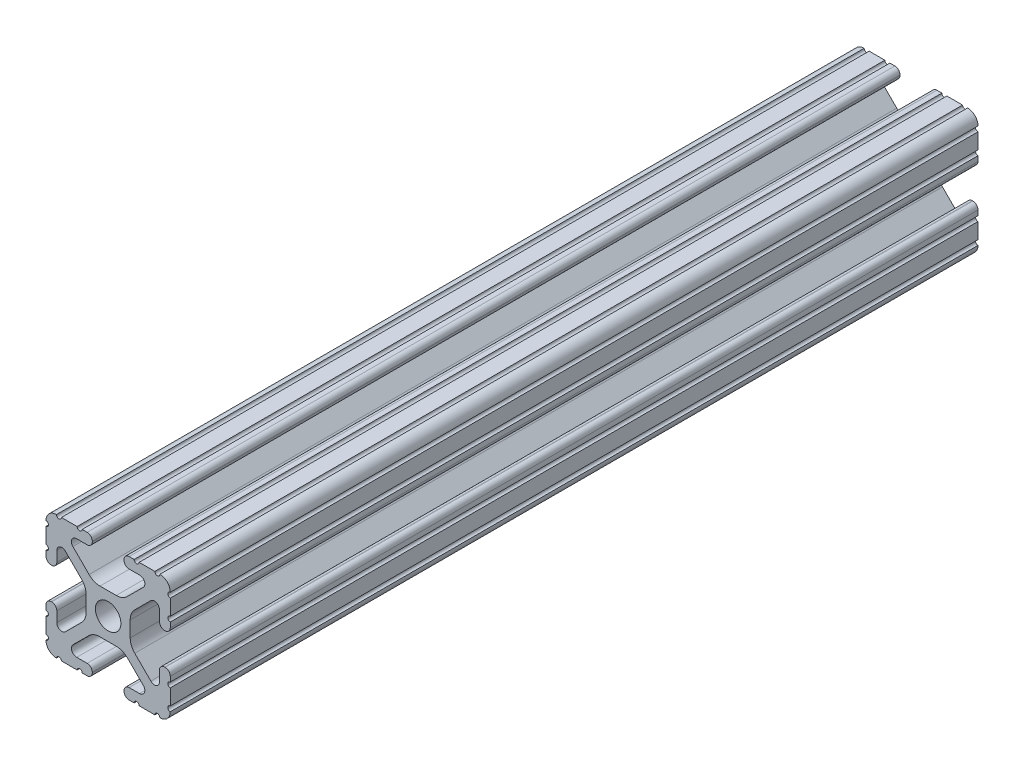
from build123d import *

# Parameters (mm, degrees)
SKETCH1_R           = 2.6035
BOSS_EXTRUDE1_DEPTH = 152.4
SKETCH3_W           = 25.4
SKETCH3_H           = 25.4
CUT_EXTRUDE1_DEPTH  = 139.7


with BuildPart() as part:
    # Sketch1 → Boss-Extrude1 (new, symmetric)
    with BuildSketch(Plane.XY):
        with BuildLine():
            Line((-7.179650497, -8.645192506), (-3.952270251, -5.423690499))
            ThreePointArc((-3.952270251, -5.423690499), (-2.922936451, -4.736929036), (-1.709253557, -4.4958))
            Line((-1.709253557, -4.4958), (1.709253557, -4.4958))
            ThreePointArc((1.709253557, -4.4958), (2.922936451, -4.736929036), (3.952270251, -5.423690499))
            Line((3.952270251, -5.423690499), (7.179650497, -8.645192506))
            ThreePointArc((7.179650497, -8.645192506), (7.41473083, -9.822813117), (6.416408329, -10.4902))
            Line((6.416408329, -10.4902), (4.287512407, -10.4902))
            ThreePointArc((4.287512407, -10.4902), (3.54574862, -10.79744862), (3.2385, -11.539212407))
            Line((3.2385, -11.539212407), (3.2385, -11.650987593))
            ThreePointArc((3.2385, -11.650987593), (3.54574862, -12.39275138), (4.287512407, -12.7))
            Line((4.287512407, -12.7), (5.317126718, -12.7))
            ThreePointArc((5.317126718, -12.7), (5.825126718, -12.192), (6.333126718, -12.7))
            Line((6.333126718, -12.7), (9.550443118, -12.7))
            ThreePointArc((9.550443118, -12.7), (10.058366869, -12.192000006), (10.566443095, -12.699847501))
            ThreePointArc((10.566443095, -12.699847501), (12.082537762, -12.08250727), (12.699846982, -10.566399977))
            ThreePointArc((12.699846982, -10.566399977), (12.192000006, -10.058323491), (12.7, -9.5504))
            Line((12.7, -9.5504), (12.7, -6.3330836))
            ThreePointArc((12.7, -6.3330836), (12.192, -5.8250836), (12.7, -5.3170836))
            Line((12.7, -5.3170836), (12.7, -4.287469289))
            ThreePointArc((12.7, -4.287469289), (12.39275138, -3.545705502), (11.650987593, -3.238456882))
            Line((11.650987593, -3.238456882), (11.539212407, -3.238456882))
            ThreePointArc((11.539212407, -3.238456882), (10.79744862, -3.545705502), (10.4902, -4.287469289))
            Line((10.4902, -4.287469289), (10.4902, -6.402089023))
            ThreePointArc((10.4902, -6.402089023), (9.856505071, -7.351067942), (8.737131347, -7.129408934))
            Line((8.737131347, -7.129408934), (5.441005833, -3.840816462))
            ThreePointArc((5.441005833, -3.840816462), (4.750877967, -2.809883091), (4.5085, -1.593185507))
            Line((4.5085, -1.593185507), (4.5085, 1.593185507))
            ThreePointArc((4.5085, 1.593185507), (4.750877967, 2.809883091), (5.441005833, 3.840816462))
            Line((5.441005833, 3.840816462), (8.737131347, 7.129408934))
            ThreePointArc((8.737131347, 7.129408934), (9.856505071, 7.351067942), (10.4902, 6.402089023))
            Line((10.4902, 6.402089023), (10.4902, 4.287469289))
            ThreePointArc((10.4902, 4.287469289), (10.79744862, 3.545705502), (11.539212407, 3.238456882))
            Line((11.539212407, 3.238456882), (11.650987593, 3.238456882))
            ThreePointArc((11.650987593, 3.238456882), (12.39275138, 3.545705502), (12.7, 4.287469289))
            Line((12.7, 4.287469289), (12.7, 5.3170836))
            ThreePointArc((12.7, 5.3170836), (12.192, 5.8250836), (12.7, 6.3330836))
            Line((12.7, 6.3330836), (12.7, 9.5504))
            ThreePointArc((12.7, 9.5504), (12.192000006, 10.058323491), (12.699846982, 10.566399977))
            ThreePointArc((12.699846982, 10.566399977), (12.082537762, 12.08250727), (10.566443095, 12.699847501))
            ThreePointArc((10.566443095, 12.699847501), (10.058366869, 12.192000006), (9.550443118, 12.7))
            Line((9.550443118, 12.7), (6.333126718, 12.7))
            ThreePointArc((6.333126718, 12.7), (5.825126718, 12.192), (5.317126718, 12.7))
            Line((5.317126718, 12.7), (4.287512407, 12.7))
            ThreePointArc((4.287512407, 12.7), (3.54574862, 12.39275138), (3.2385, 11.650987593))
            Line((3.2385, 11.650987593), (3.2385, 11.539212407))
            ThreePointArc((3.2385, 11.539212407), (3.54574862, 10.79744862), (4.287512407, 10.4902))
            Line((4.287512407, 10.4902), (6.476788598, 10.4902))
            ThreePointArc((6.476788598, 10.4902), (7.432222385, 9.85140422), (7.207036008, 8.724370562))
            Line((7.207036008, 8.724370562), (3.898272566, 5.423169045))
            ThreePointArc((3.898272566, 5.423169045), (2.869120213, 4.736787962), (1.655778399, 4.4958))
            Line((1.655778399, 4.4958), (-1.655778399, 4.4958))
            ThreePointArc((-1.655778399, 4.4958), (-2.869120213, 4.736787962), (-3.898272566, 5.423169045))
            Line((-3.898272566, 5.423169045), (-7.207036008, 8.724370562))
            ThreePointArc((-7.207036008, 8.724370562), (-7.432222385, 9.85140422), (-6.476788598, 10.4902))
            Line((-6.476788598, 10.4902), (-4.287512407, 10.4902))
            ThreePointArc((-4.287512407, 10.4902), (-3.54574862, 10.79744862), (-3.2385, 11.539212407))
            Line((-3.2385, 11.539212407), (-3.2385, 11.650987593))
            ThreePointArc((-3.2385, 11.650987593), (-3.54574862, 12.39275138), (-4.287512407, 12.7))
            Line((-4.287512407, 12.7), (-5.317126718, 12.7))
            ThreePointArc((-5.317126718, 12.7), (-5.825126718, 12.192), (-6.333126718, 12.7))
            Line((-6.333126718, 12.7), (-9.550443118, 12.7))
            ThreePointArc((-9.550443118, 12.7), (-10.058366869, 12.192000006), (-10.566443095, 12.699847501))
            ThreePointArc((-10.566443095, 12.699847501), (-12.082537762, 12.08250727), (-12.699846982, 10.566399977))
            ThreePointArc((-12.699846982, 10.566399977), (-12.192000006, 10.058323491), (-12.7, 9.5504))
            Line((-12.7, 9.5504), (-12.7, 6.3330836))
            ThreePointArc((-12.7, 6.3330836), (-12.192, 5.8250836), (-12.7, 5.3170836))
            Line((-12.7, 5.3170836), (-12.7, 4.287469289))
            ThreePointArc((-12.7, 4.287469289), (-12.39275138, 3.545705502), (-11.650987593, 3.238456882))
            Line((-11.650987593, 3.238456882), (-11.539212407, 3.238456882))
            ThreePointArc((-11.539212407, 3.238456882), (-10.79744862, 3.545705502), (-10.4902, 4.287469289))
            Line((-10.4902, 4.287469289), (-10.4902, 6.402089023))
            ThreePointArc((-10.4902, 6.402089023), (-9.856505071, 7.351067942), (-8.737131347, 7.129408934))
            Line((-8.737131347, 7.129408934), (-5.441005833, 3.840816462))
            ThreePointArc((-5.441005833, 3.840816462), (-4.750877967, 2.809883091), (-4.5085, 1.593185507))
            Line((-4.5085, 1.593185507), (-4.5085, -1.593185507))
            ThreePointArc((-4.5085, -1.593185507), (-4.750877967, -2.809883091), (-5.441005833, -3.840816462))
            Line((-5.441005833, -3.840816462), (-8.737131347, -7.129408934))
            ThreePointArc((-8.737131347, -7.129408934), (-9.856505071, -7.351067942), (-10.4902, -6.402089023))
            Line((-10.4902, -6.402089023), (-10.4902, -4.287469289))
            ThreePointArc((-10.4902, -4.287469289), (-10.79744862, -3.545705502), (-11.539212407, -3.238456882))
            Line((-11.539212407, -3.238456882), (-11.650987593, -3.238456882))
            ThreePointArc((-11.650987593, -3.238456882), (-12.39275138, -3.545705502), (-12.7, -4.287469289))
            Line((-12.7, -4.287469289), (-12.7, -5.3170836))
            ThreePointArc((-12.7, -5.3170836), (-12.192, -5.8250836), (-12.7, -6.3330836))
            Line((-12.7, -6.3330836), (-12.7, -9.5504))
            ThreePointArc((-12.7, -9.5504), (-12.192000006, -10.058323491), (-12.699846982, -10.566399977))
            ThreePointArc((-12.699846982, -10.566399977), (-12.082537762, -12.08250727), (-10.566443095, -12.699847501))
            ThreePointArc((-10.566443095, -12.699847501), (-10.058366869, -12.192000006), (-9.550443118, -12.7))
            Line((-9.550443118, -12.7), (-6.333126718, -12.7))
            ThreePointArc((-6.333126718, -12.7), (-5.825126718, -12.192), (-5.317126718, -12.7))
            Line((-5.317126718, -12.7), (-4.287512407, -12.7))
            ThreePointArc((-4.287512407, -12.7), (-3.54574862, -12.39275138), (-3.2385, -11.650987593))
            Line((-3.2385, -11.650987593), (-3.2385, -11.539212407))
            ThreePointArc((-3.2385, -11.539212407), (-3.54574862, -10.79744862), (-4.287512407, -10.4902))
            Line((-4.287512407, -10.4902), (-6.416408329, -10.4902))
            ThreePointArc((-6.416408329, -10.4902), (-7.41473083, -9.822813117), (-7.179650497, -8.645192506))
        make_face()
        with Locations(Location((0, 0, 0), (0, 0, 180))):
            Circle(SKETCH1_R, mode=Mode.SUBTRACT)
    extrude(amount=BOSS_EXTRUDE1_DEPTH, both=True)

    # Sketch3 → Cut-Extrude1 (cut)
    with BuildSketch(Plane.XY.offset(152.4)):
        Rectangle(SKETCH3_W, SKETCH3_H)
    extrude(amount=-CUT_EXTRUDE1_DEPTH, mode=Mode.SUBTRACT)


solid = part.part
